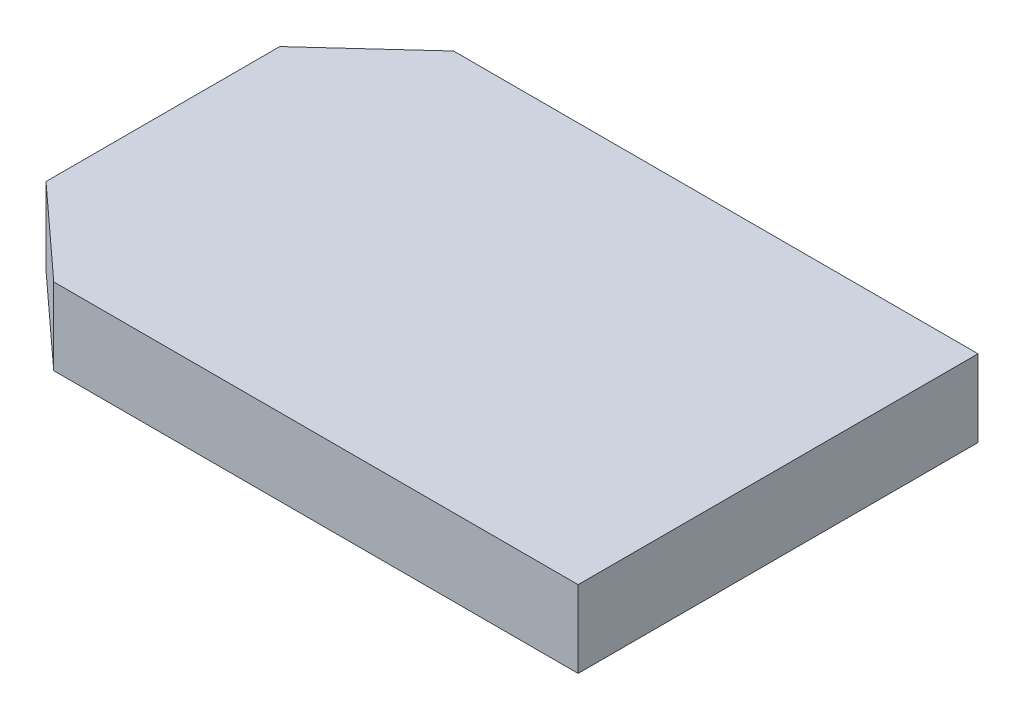
from build123d import *

# Parameters (mm, degrees)
BOSS_EXTRUDE1_DEPTH = 31.75


with BuildPart() as part:
    # Sketch1 → Boss-Extrude1 (new body)
    with BuildSketch(Plane(origin=(0, 0, 0), x_dir=(1, 0, 0), z_dir=(0, 1, 0))):
        Polygon((-127, -48.26), (-127, 48.26), (-89.518859409, 82.55), (127, 82.55), (127, -82.55), (-89.518859409, -82.55), align=None)
    extrude(amount=BOSS_EXTRUDE1_DEPTH)


solid = part.part
